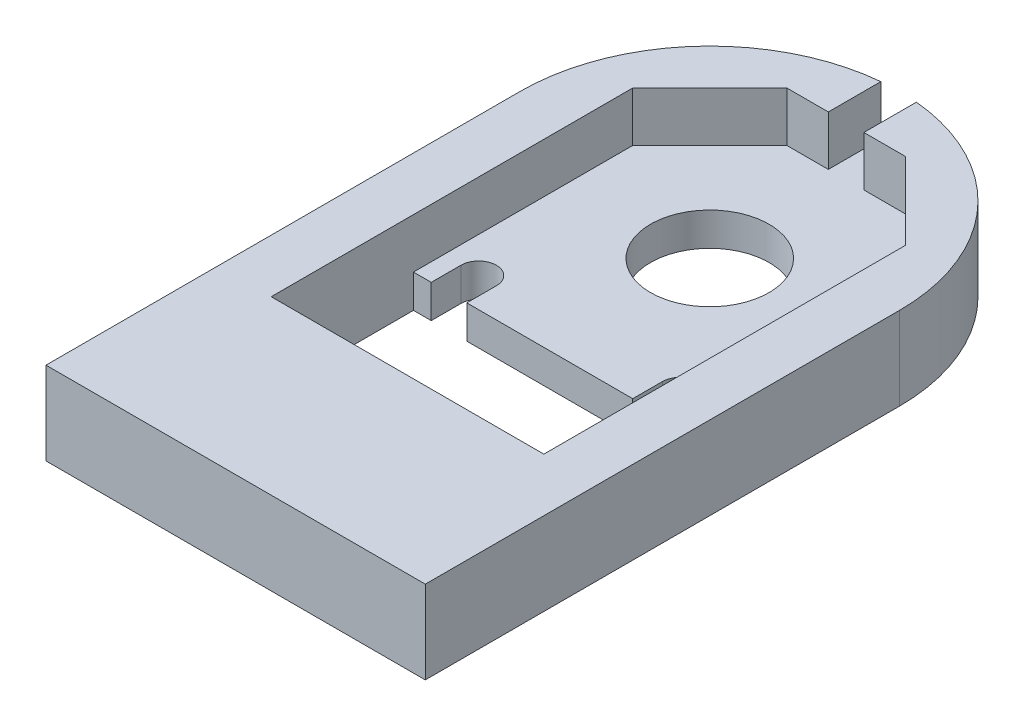
from build123d import *

# Parameters (mm, degrees)
BOSS_EXTRUDE1_DEPTH = 2.1
BOSS_EXTRUDE2_START = -1.4
SKETCH2_R           = 2.5
BOSS_EXTRUDE2_DEPTH = 1.4
SKETCH3_W           = 11.5
SKETCH3_H           = 6
CUT_EXTRUDE1_DEPTH  = 22.823152843
CHAMFER1_SIZE       = 2.5
CHAMFER1_SIZE2      = 4


with BuildPart() as part:
    # Sketch1 → Boss-Extrude1 (new body)
    with BuildSketch(Plane(origin=(0, 0, 0), x_dir=(1, 0, 0), z_dir=(0, 1, 0))):
        with BuildLine():
            Line((-5.75, 2.5), (-2.5, 5.75))
            Line((-2.5, 5.75), (-0.75, 5.75))
            Line((-0.75, 5.75), (-0.75, 7.964766161))
            ThreePointArc((-0.75, 7.964766161), (-5.916079783, 5.385164807), (-8, 0))
            Line((-8, 0), (-8, -20))
            Line((-8, -20), (8, -20))
            Line((8, -20), (8, 0))
            ThreePointArc((8, 0), (5.916079783, 5.385164807), (0.75, 7.964766161))
            Line((0.75, 7.964766161), (0.75, 5.75))
            Line((0.75, 5.75), (2.5, 5.75))
            Line((2.5, 5.75), (5.75, 2.5))
            Line((5.75, 2.5), (5.75, -6.75))
            Line((5.75, -6.75), (-5.75, -6.75))
            Line((-5.75, -6.75), (-5.75, 2.5))
        make_face()
    extrude(amount=BOSS_EXTRUDE1_DEPTH)

    # Sketch2 → Boss-Extrude2 (add)
    with BuildSketch(Plane(origin=(0, 0, 0), x_dir=(1, 0, 0), z_dir=(0, 1, 0)).offset(BOSS_EXTRUDE2_START)):
        with BuildLine():
            Line((8, 0), (8, -20))
            Line((8, -20), (-8, -20))
            Line((-8, -20), (-8, 0))
            ThreePointArc((-8, 0), (0, 8), (8, 0))
        make_face()
        with Locations(Location((0, 0, 0), (0, 0, 270))):
            Circle(SKETCH2_R, mode=Mode.SUBTRACT)
        with BuildLine():
            Line((-5, -5.5), (-5, -6.75))
            Line((-5, -6.75), (-3.5, -6.75))
            Line((-3.5, -6.75), (-3.5, -5.5))
            ThreePointArc((-3.5, -5.5), (-4.25, -4.75), (-5, -5.5))
        make_face(mode=Mode.SUBTRACT)
        with BuildLine():
            Line((3.5, -5.5), (3.5, -6.75))
            Line((3.5, -6.75), (5, -6.75))
            Line((5, -6.75), (5, -5.5))
            ThreePointArc((5, -5.5), (4.25, -4.75), (3.5, -5.5))
        make_face(mode=Mode.SUBTRACT)
    extrude(amount=BOSS_EXTRUDE2_DEPTH)

    # Sketch3 → Cut-Extrude1 (cut, through all)
    with BuildSketch(Plane(origin=(0, 2.1, 0), x_dir=(1, 0, 0), z_dir=(0, 1, 0))):
        with Locations((0, -9.75)):
            Rectangle(SKETCH3_W, SKETCH3_H)
    extrude(amount=-CUT_EXTRUDE1_DEPTH, mode=Mode.SUBTRACT)

    # Chamfer1
    chamfer1_edges = [part.edges().sort_by_distance(p)[0] for p in [
        (0, -1.4, 12.75),
    ]]
    chamfer1_side = [part.faces().sort_by_distance(p)[0] for p in [
        (0, 0.35, 12.75),
    ]]
    chamfer(chamfer1_edges, length=CHAMFER1_SIZE, length2=CHAMFER1_SIZE2, reference=chamfer1_side[0])


solid = part.part
